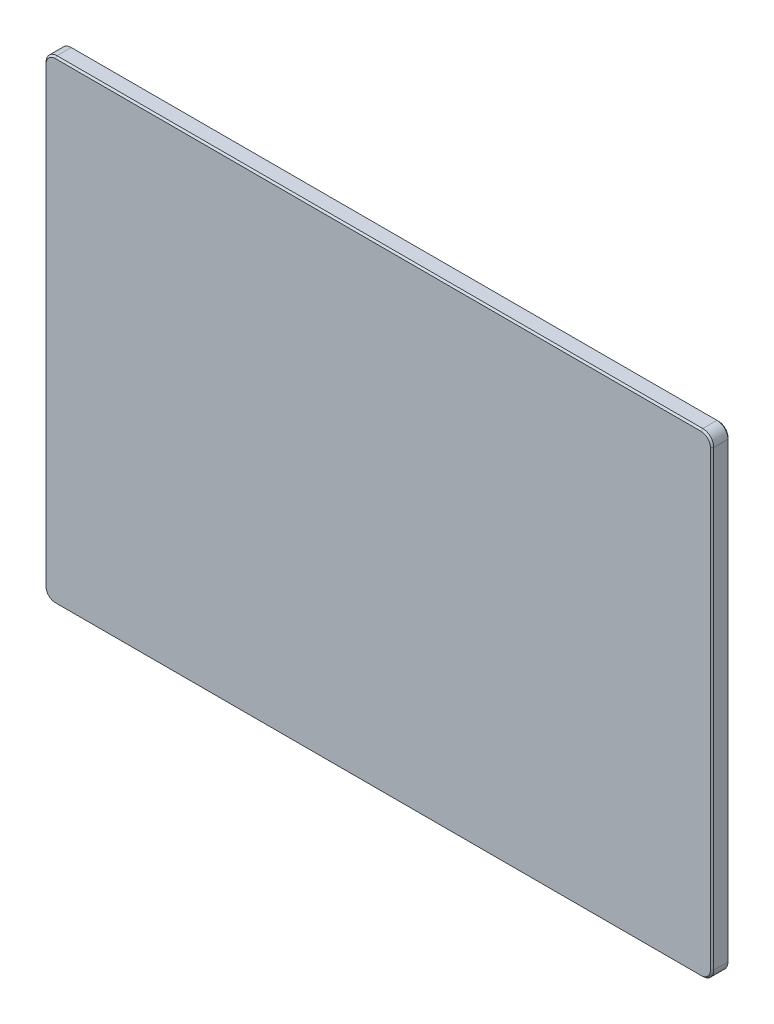
from build123d import *

# Parameters (mm, degrees)
SKETCH1_W           = 305.3
SKETCH1_H           = 217
BOSS_EXTRUDE1_DEPTH = 8
FILLET1_R           = 5
CHAMFER1_SIZE       = 0.75


with BuildPart() as part:
    # Sketch1 → Boss-Extrude1 (new body)
    with BuildSketch(Plane.XY.offset(8)):
        Rectangle(SKETCH1_W, SKETCH1_H)
    extrude(amount=-BOSS_EXTRUDE1_DEPTH)

    # Fillet1
    fillet1_edges = [part.edges().sort_by_distance(p)[0] for p in [
        (-152.65, 108.5, 4),
        (152.65, 108.5, 4),
        (152.65, -108.5, 4),
        (-152.65, -108.5, 4),
    ]]
    fillet(fillet1_edges, radius=FILLET1_R)

    # Chamfer1
    chamfer1_edges = [part.edges().sort_by_distance(p)[0] for p in [
        (152.65, 0, 8),
        (152.65, 0, 0),
        (-152.65, 0, 8),
        (0, -108.5, 8),
        (0, 108.5, 8),
        (-151.185533906, -107.035533906, 8),
        (-151.185533906, 107.035533906, 8),
        (151.185533906, -107.035533906, 8),
        (151.185533906, 107.035533906, 8),
        (0, 108.5, 0),
        (-152.65, 0, 0),
        (0, -108.5, 0),
        (-151.185533906, -107.035533906, 0),
        (-151.185533906, 107.035533906, 0),
        (151.185533906, -107.035533906, 0),
        (151.185533906, 107.035533906, 0),
    ]]
    chamfer(chamfer1_edges, length=CHAMFER1_SIZE)


solid = part.part
